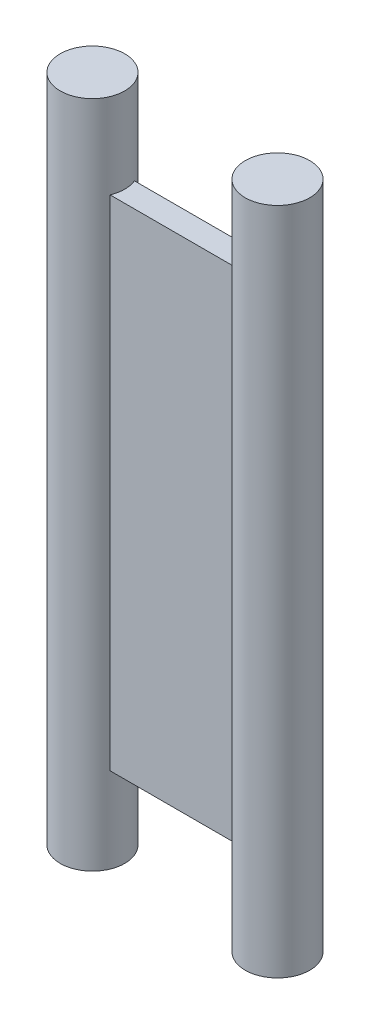
from build123d import *

# Parameters (mm, degrees)
SKETCH1_W           = 7.606
SKETCH1_H           = 1
BOSS_EXTRUDE1_DEPTH = 20.5
SKETCH2_R           = 1.325
BOSS_EXTRUDE2_DEPTH = 13.75


with BuildPart() as part:
    # Sketch1 → Boss-Extrude1 (new body)
    with BuildSketch(Plane(origin=(0, 0, 0), x_dir=(1, 0, 0), z_dir=(0, 1, 0))):
        Rectangle(SKETCH1_W, SKETCH1_H)
    extrude(amount=BOSS_EXTRUDE1_DEPTH)

    # Sketch2 → Boss-Extrude2 (add, symmetric)
    with BuildSketch(Plane(origin=(0, 10.25, 0), x_dir=(1, 0, 0), z_dir=(0, 1, 0))):
        with Locations(Location((-3.803, 0, 0), (0, 0, 270))):
            Circle(SKETCH2_R)
        with Locations(Location((3.803, 0, 0), (0, 0, 270))):
            Circle(SKETCH2_R)
    extrude(amount=BOSS_EXTRUDE2_DEPTH, both=True)


solid = part.part
